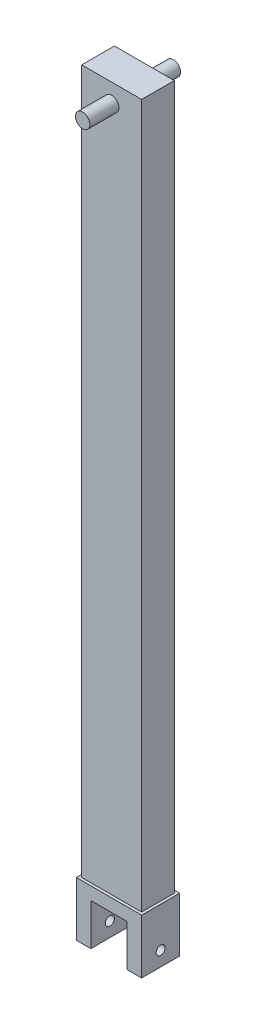
from build123d import *

# Parameters (mm, degrees)
SKETCH1_W           = 33
SKETCH1_H           = 18
BOSS_EXTRUDE1_DEPTH = 388
SKETCH3_R           = 4
BOSS_EXTRUDE2_DEPTH = 25
SKETCH4_W           = 36
SKETCH4_H           = 21
BOSS_EXTRUDE3_DEPTH = 30
SKETCH5_W           = 20
SKETCH5_H           = 45.982478268
CUT_EXTRUDE1_DEPTH  = 391.036216267
SKETCH6_R           = 2.5
CUT_EXTRUDE2_DEPTH  = 391.467668316


with BuildPart() as part:
    # Sketch1 → Boss-Extrude1 (new body)
    with BuildSketch(Plane(origin=(0, 0, 0), x_dir=(1, 0, 0), z_dir=(0, 1, 0))):
        Rectangle(SKETCH1_W, SKETCH1_H)
    extrude(amount=BOSS_EXTRUDE1_DEPTH)

    # Sketch3 → Boss-Extrude2 (add, symmetric)
    with BuildSketch(Plane.XY):
        with Locations(Location((0, 377.75, 0), (0, 0, 180))):
            Circle(SKETCH3_R)
    extrude(amount=BOSS_EXTRUDE2_DEPTH, both=True)

    # Sketch4 → Boss-Extrude3 (add)
    with BuildSketch(Plane.XZ):
        Rectangle(SKETCH4_W, SKETCH4_H)
    extrude(amount=BOSS_EXTRUDE3_DEPTH)

    # Sketch5 → Cut-Extrude1 (cut, through all)
    with BuildSketch(Plane.XY.offset(10.5)):
        with Locations((0, -30)):
            Rectangle(SKETCH5_W, SKETCH5_H)
    extrude(amount=-CUT_EXTRUDE1_DEPTH, mode=Mode.SUBTRACT)

    # Sketch6 → Cut-Extrude2 (cut, through all)
    with BuildSketch(Plane(origin=(18, 0, 0), x_dir=(0, 0, -1), z_dir=(1, 0, 0))):
        with Locations((0, -22)):
            Circle(SKETCH6_R)
    extrude(amount=-CUT_EXTRUDE2_DEPTH, mode=Mode.SUBTRACT)


solid = part.part
